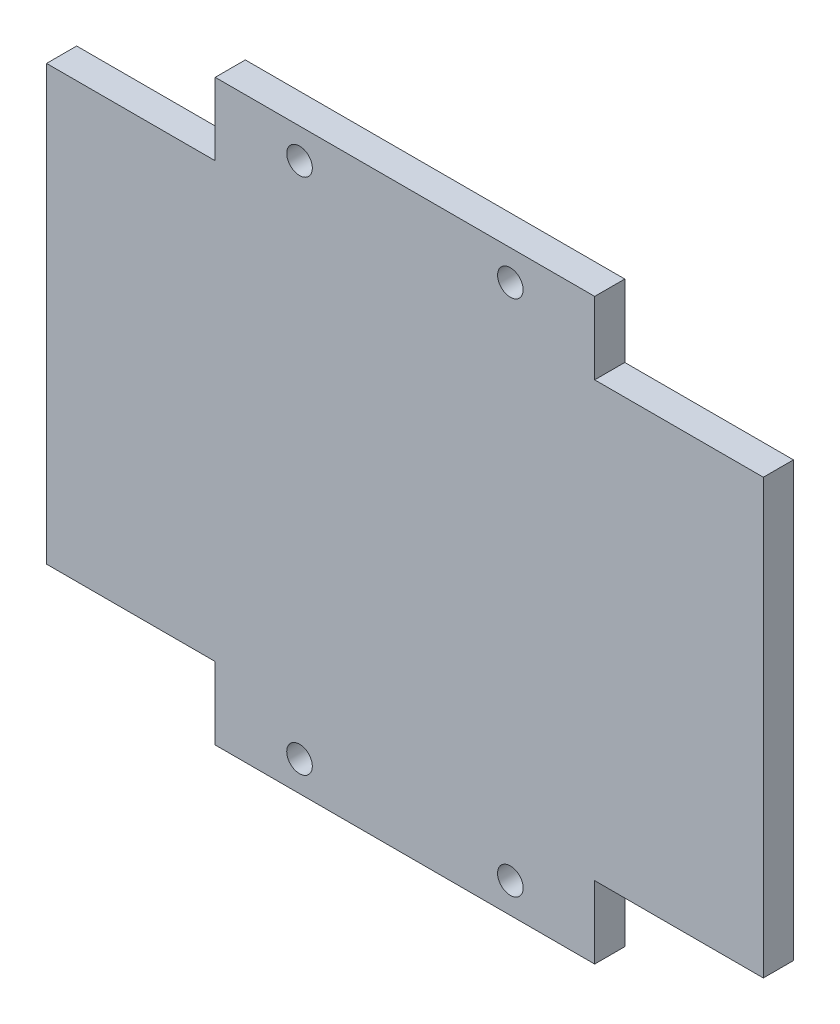
from build123d import *

# Parameters (mm, degrees)
SKETCH2_W           = 63
SKETCH2_H           = 96
BOSS_EXTRUDE1_DEPTH = 5
SKETCH3_R           = 2.125
CUT_EXTRUDE1_DEPTH  = 5
SKETCH4_W           = 28
SKETCH4_H           = 72
BOSS_EXTRUDE2_DEPTH = 5


with BuildPart() as part:
    # Sketch2 → Boss-Extrude1 (new body)
    with BuildSketch(Plane.XY):
        with Locations((31.5, 48)):
            Rectangle(SKETCH2_W, SKETCH2_H)
    extrude(amount=BOSS_EXTRUDE1_DEPTH)

    # Sketch3 → Cut-Extrude1 (cut)
    with BuildSketch(Plane.XY.offset(5)):
        with Locations((14, 91)):
            Circle(SKETCH3_R)
        with Locations(Location((49, 91, 0), (0, 0, 180))):
            Circle(SKETCH3_R)
        with Locations((49, 5)):
            Circle(SKETCH3_R)
        with Locations(Location((14, 5, 0), (0, 0, 180))):
            Circle(SKETCH3_R)
    extrude(amount=-CUT_EXTRUDE1_DEPTH, mode=Mode.SUBTRACT)

    # Sketch4 → Boss-Extrude2 (add)
    with BuildSketch(Plane.XY.offset(5)):
        with Locations((77, 48)):
            Rectangle(SKETCH4_W, SKETCH4_H)
        with Locations((-14, 48)):
            Rectangle(SKETCH4_W, SKETCH4_H)
    extrude(amount=-BOSS_EXTRUDE2_DEPTH)


solid = part.part
